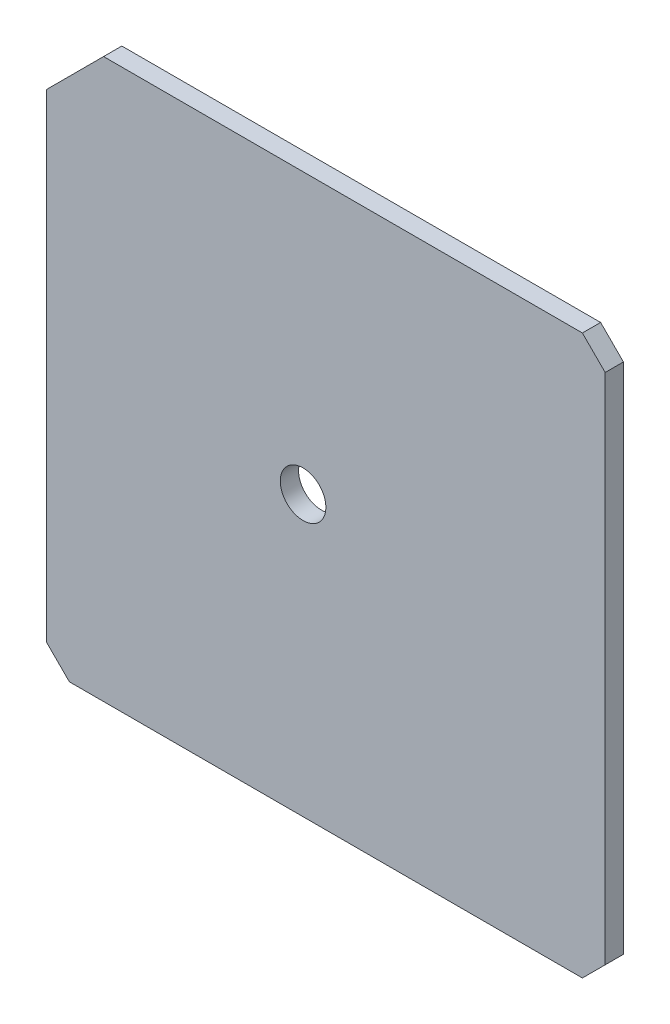
from build123d import *

# Parameters (mm, degrees)
SKETCH1_W           = 49
SKETCH1_H           = 49
SKETCH1_R           = 2
BOSS_EXTRUDE1_DEPTH = 1.6
CHAMFER1_SIZE       = 5
CHAMFER2_SIZE       = 2


with BuildPart() as part:
    # Sketch1 → Boss-Extrude1 (new body)
    with BuildSketch(Plane(origin=(0, 0, 0), x_dir=(0, 1, 0), z_dir=(0, 0, 1))):
        with Locations((24.5, 24.5)):
            Rectangle(SKETCH1_W, SKETCH1_H)
        with Locations(Location((24.5, 26.5, 0), (0, 0, 270))):
            Circle(SKETCH1_R, mode=Mode.SUBTRACT)
    extrude(amount=-BOSS_EXTRUDE1_DEPTH)

    # Chamfer1
    chamfer1_edges = [part.edges().sort_by_distance(p)[0] for p in [
        (-49, 49, -0.8),
    ]]
    chamfer(chamfer1_edges, length=CHAMFER1_SIZE)

    # Chamfer2
    chamfer2_edges = [part.edges().sort_by_distance(p)[0] for p in [
        (-49, 0, -0.8),
        (0, 49, -0.8),
        (0, 0, -0.8),
    ]]
    chamfer(chamfer2_edges, length=CHAMFER2_SIZE)


solid = part.part
